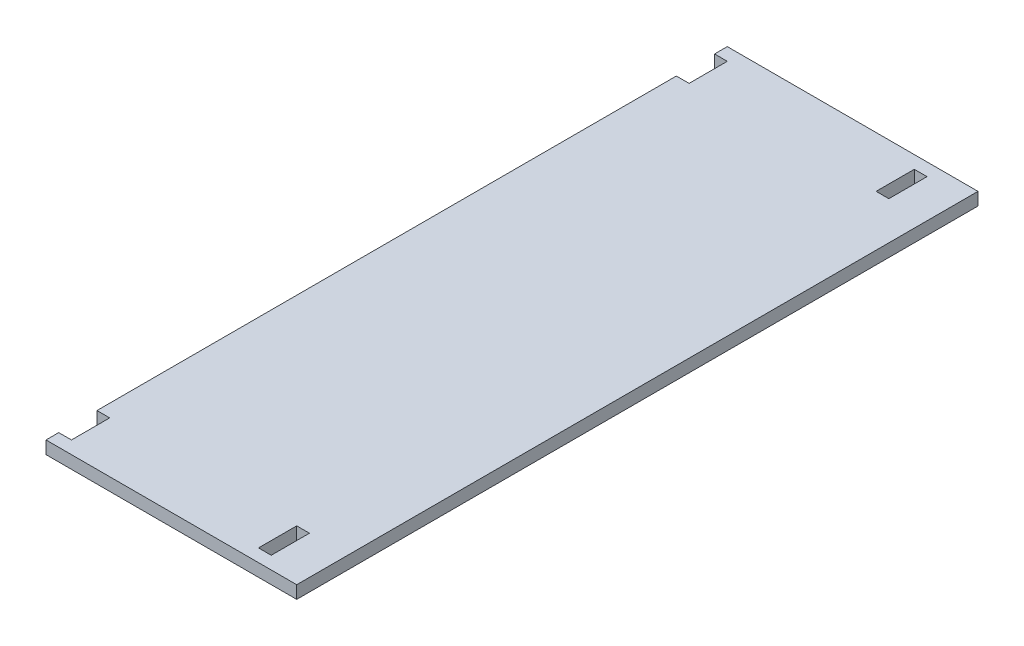
from build123d import *

# Parameters (mm, degrees)
SKETCH1_W           = 3.175
SKETCH1_H           = 9.525
BOSS_EXTRUDE1_DEPTH = 3.175


with BuildPart() as part:
    # Sketch1 → Boss-Extrude1 (new body)
    with BuildSketch(Plane(origin=(0, 0, 0), x_dir=(1, 0, 0), z_dir=(0, 1, 0))):
        Polygon((-31.242, 72.1995), (-28.067, 72.1995), (-28.067, 81.7245), (-31.242, 81.7245), (-31.242, 84.8995), (31.242, 84.8995), (31.242, -84.8995), (-31.242, -84.8995), (-31.242, -81.7245), (-28.067, -81.7245), (-28.067, -72.1995), (-31.242, -72.1995), align=None)
        with Locations((20.1295, 76.962)):
            Rectangle(SKETCH1_W, SKETCH1_H, mode=Mode.SUBTRACT)
        with Locations((20.1295, -76.962)):
            Rectangle(SKETCH1_W, SKETCH1_H, mode=Mode.SUBTRACT)
    extrude(amount=BOSS_EXTRUDE1_DEPTH)


solid = part.part
